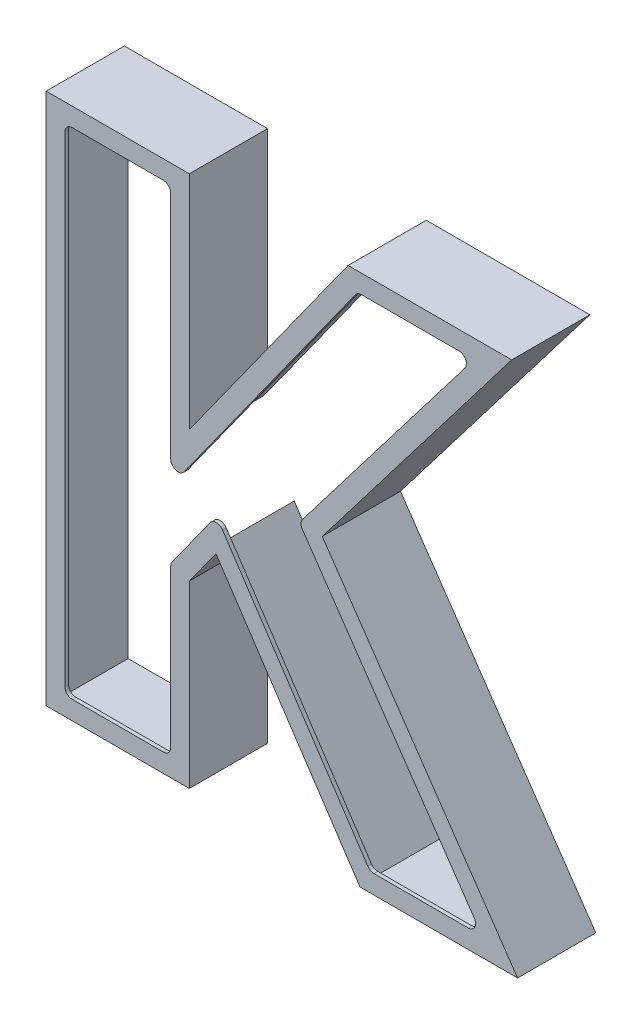
from build123d import *

# Parameters (mm, degrees)
BOSS_EXTRUDE1_DEPTH      = 1
BOSS_EXTRUDE1_DEPTH_BACK = 20
CUT_EXTRUDE1_DEPTH       = 3592.061255037
CUT_EXTRUDE2_DEPTH       = 20
FILLET1_R                = 2


with BuildPart() as part:
    # Sketch1 → Boss-Extrude1 (new, two sides: drawn at the far end of the back side and taken through both)
    with BuildSketch(Plane.XY.offset(-BOSS_EXTRUDE1_DEPTH_BACK)):
        Polygon((3103.577529919, -1502.582577839), (3065.134491945, -1502.582577839), (3065.134491945, -1645.582577839), (3103.577529919, -1645.582577839), (3103.577529919, -1597.326675007), (3110.72435951, -1587.380291149), (3149.426300029, -1645.582577839), (3191.76094295, -1645.582577839), (3139.289451926, -1569.091055151), (3190.177225487, -1502.582577839), (3146.219923507, -1502.582577839), (3103.577529919, -1562.103156805), align=None)
    extrude(amount=BOSS_EXTRUDE1_DEPTH + BOSS_EXTRUDE1_DEPTH_BACK)

    # Sketch2 → Cut-Extrude1 (cut, through all)
    with BuildSketch(Plane.XY.offset(1)):
        Polygon((3098.577529919, -1577.667471643), (3098.577529919, -1507.582577839), (3070.134491945, -1507.582577839), (3070.134491945, -1640.582577839), (3098.577529919, -1640.582577839), (3098.577529919, -1595.716604278), (3110.883661718, -1578.589917667), (3152.106032574, -1640.582577839), (3182.26770964, -1640.582577839), (3133.116273086, -1568.930940904), (3180.055877392, -1507.582577839), (3148.788527159, -1507.582577839), align=None)
    extrude(amount=-CUT_EXTRUDE1_DEPTH, mode=Mode.SUBTRACT)

    # Sketch3 → Cut-Extrude2 (cut)
    with BuildSketch(Plane(origin=(0, 0, -20), x_dir=(-1, 0, 0), z_dir=(0, 0, -1))):
        Polygon((-3102.577529919, -1503.582577839), (-3102.577529919, -1565.216019773), (-3146.733644238, -1503.582577839), (-3188.152955868, -1503.582577839), (-3138.054816158, -1569.059032301), (-3189.862296288, -1644.582577839), (-3149.962246538, -1644.582577839), (-3110.756219952, -1585.622216453), (-3102.577529919, -1597.004660861), (-3102.577529919, -1644.582577839), (-3066.134491945, -1644.582577839), (-3066.134491945, -1503.582577839), align=None)
    extrude(amount=-CUT_EXTRUDE2_DEPTH, mode=Mode.SUBTRACT)

    # Fillet1
    fillet1_edges = [part.edges().sort_by_distance(p)[0] for p in [
        (3098.577529919, -1507.582577839, 0.5),
        (3098.577529919, -1577.667471643, 0.5),
        (3070.134491945, -1507.582577839, 0.5),
        (3070.134491945, -1640.582577839, 0.5),
        (3098.577529919, -1640.582577839, 0.5),
        (3098.577529919, -1595.716604278, 0.5),
        (3110.883661718, -1578.589917667, 0.5),
        (3152.106032574, -1640.582577839, 0.5),
        (3182.26770964, -1640.582577839, 0.5),
        (3133.116273086, -1568.930940904, 0.5),
        (3180.055877392, -1507.582577839, 0.5),
        (3148.788527159, -1507.582577839, 0.5),
    ]]
    fillet(fillet1_edges, radius=FILLET1_R)


solid = part.part
